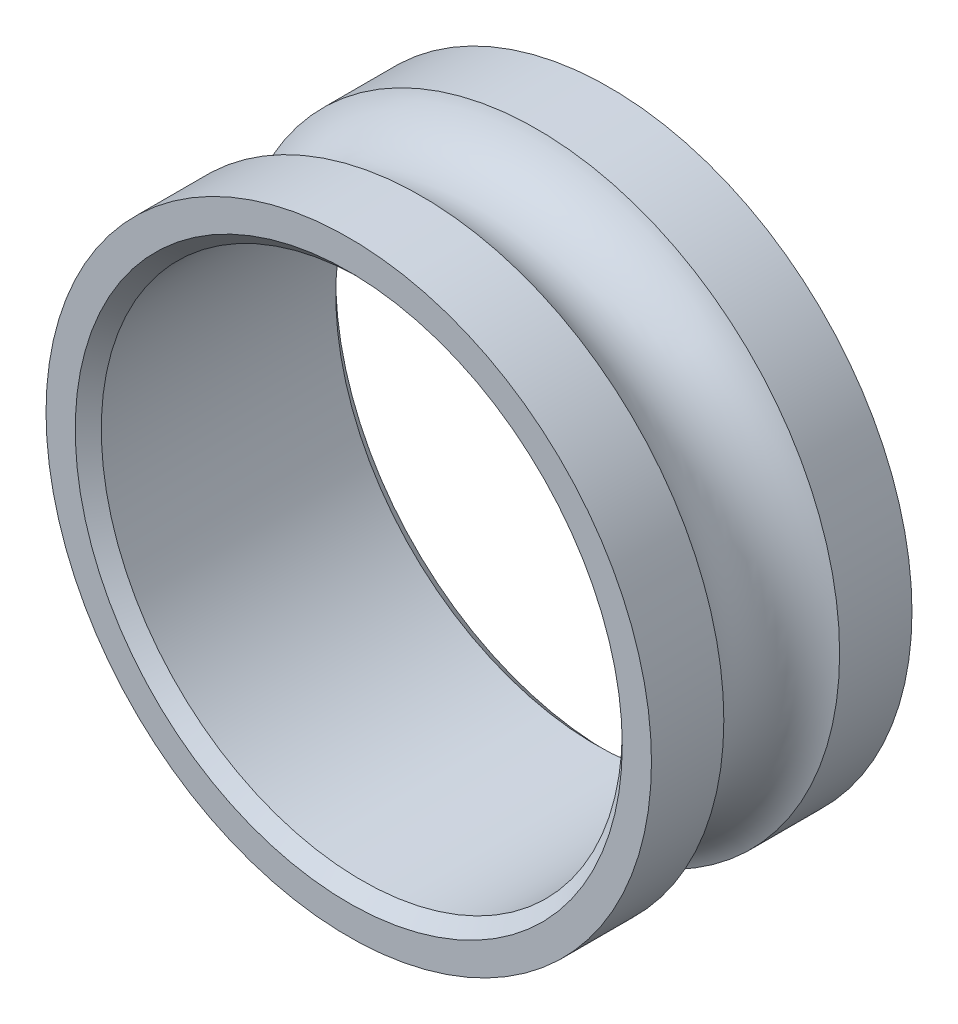
from build123d import *


with BuildPart() as part:
    # Sketch1 → Revolve1 (revolve)
    with BuildSketch(Plane(origin=(0, 0, 0), x_dir=(1, 0, 0), z_dir=(0, 1, 0))):
        with BuildLine():
            Line((3.689629121, -1.5875), (3.689629121, -0.705555556))
            ThreePointArc((3.689629121, -0.705555556), (3.209989756, 0), (3.689629121, 0.705555556))
            Line((3.689629121, 0.705555556), (3.689629121, 1.5875))
            Line((3.689629121, 1.5875), (3.33375, 1.5875))
            Line((3.33375, 1.5875), (3.175, 1.42875))
            Line((3.175, 1.42875), (3.175, -1.42875))
            Line((3.175, -1.42875), (3.33375, -1.5875))
            Line((3.33375, -1.5875), (3.689629121, -1.5875))
        make_face()
    revolve(axis=Axis((0, 0, -1.5875), (0, 0, 1)))


solid = part.part
